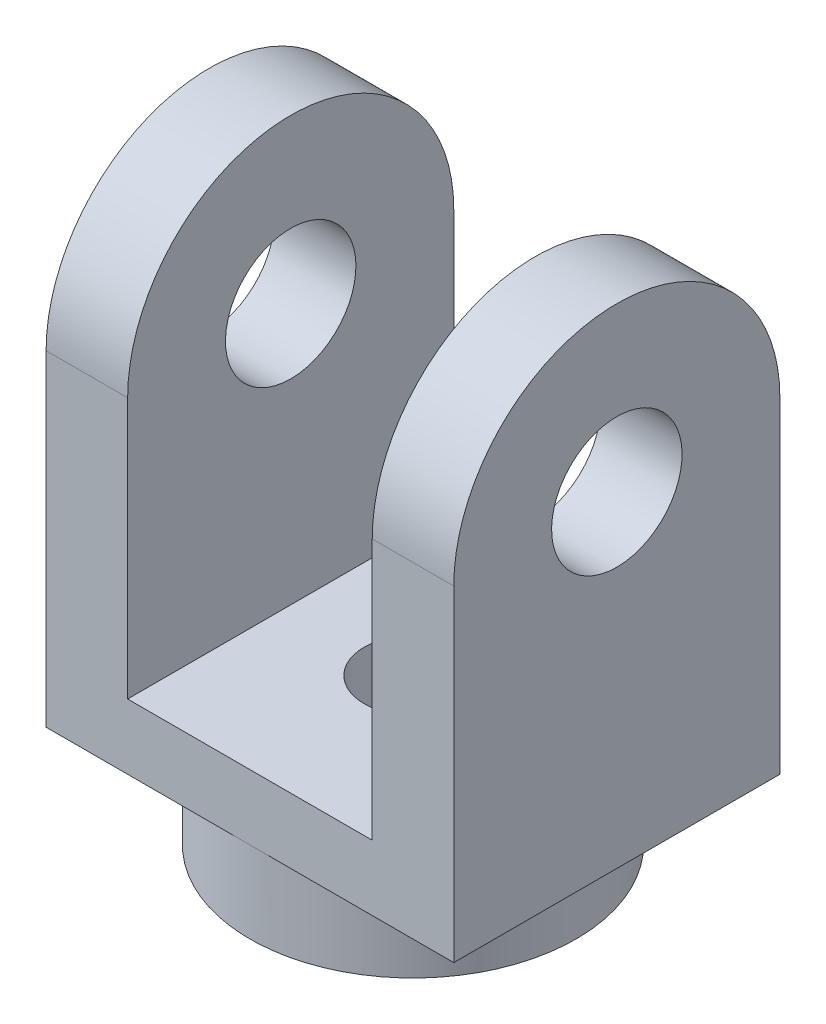
from build123d import *

# Parameters (mm, degrees)
BOSS_EXTRUDE1_DEPTH = 50
SKETCH3_R           = 50
BOSS_EXTRUDE5_DEPTH = 25
SKETCH4_R           = 20
CUT_EXTRUDE1_DEPTH  = 25
SKETCH8_R           = 15
CUT_EXTRUDE2_DEPTH  = 153.663846408
SKETCH9_R           = 50
SKETCH9_R_2         = 37.5
BOSS_EXTRUDE6_DEPTH = 25


with BuildPart() as part:
    # Sketch1 → Boss-Extrude1 (new, symmetric)
    with BuildSketch(Plane.XY):
        Polygon((-62.5, 125), (-62.5, 25), (62.5, 25), (62.5, 125), (37.5, 125), (37.5, 45), (-37.5, 45), (-37.5, 125), align=None)
    extrude(amount=BOSS_EXTRUDE1_DEPTH, both=True)

    # Sketch3 → Boss-Extrude5 (add)
    with BuildSketch(Plane.ZY.offset(62.5)):
        with Locations((0, 125)):
            Circle(SKETCH3_R)
    boss_extrude5 = extrude(amount=-BOSS_EXTRUDE5_DEPTH)

    # Sketch4 → Cut-Extrude1 (cut)
    with BuildSketch(Plane.ZY.offset(62.5)):
        with Locations((0, 125)):
            Circle(SKETCH4_R)
    cut_extrude1 = extrude(amount=-CUT_EXTRUDE1_DEPTH, mode=Mode.SUBTRACT)

    # Mirror1: Boss-Extrude5, Cut-Extrude1 across plane
    add(boss_extrude5.mirror(Plane(origin=(0, 0, 0), x_dir=(0, 0, 1), z_dir=(1, 0, 0))))
    add(cut_extrude1.mirror(Plane(origin=(0, 0, 0), x_dir=(0, 0, 1), z_dir=(1, 0, 0))), mode=Mode.SUBTRACT)

    # Sketch8 → Cut-Extrude2 (cut, through all)
    with BuildSketch(Plane(origin=(0, 45, 0), x_dir=(1, 0, 0), z_dir=(0, 1, 0))):
        Circle(SKETCH8_R)
    extrude(amount=-CUT_EXTRUDE2_DEPTH, mode=Mode.SUBTRACT)

    # Sketch9 → Boss-Extrude6 (add)
    with BuildSketch(Plane.XZ.offset(-25)):
        Circle(SKETCH9_R)
        Circle(SKETCH9_R_2, mode=Mode.SUBTRACT)
    extrude(amount=BOSS_EXTRUDE6_DEPTH)


solid = part.part
